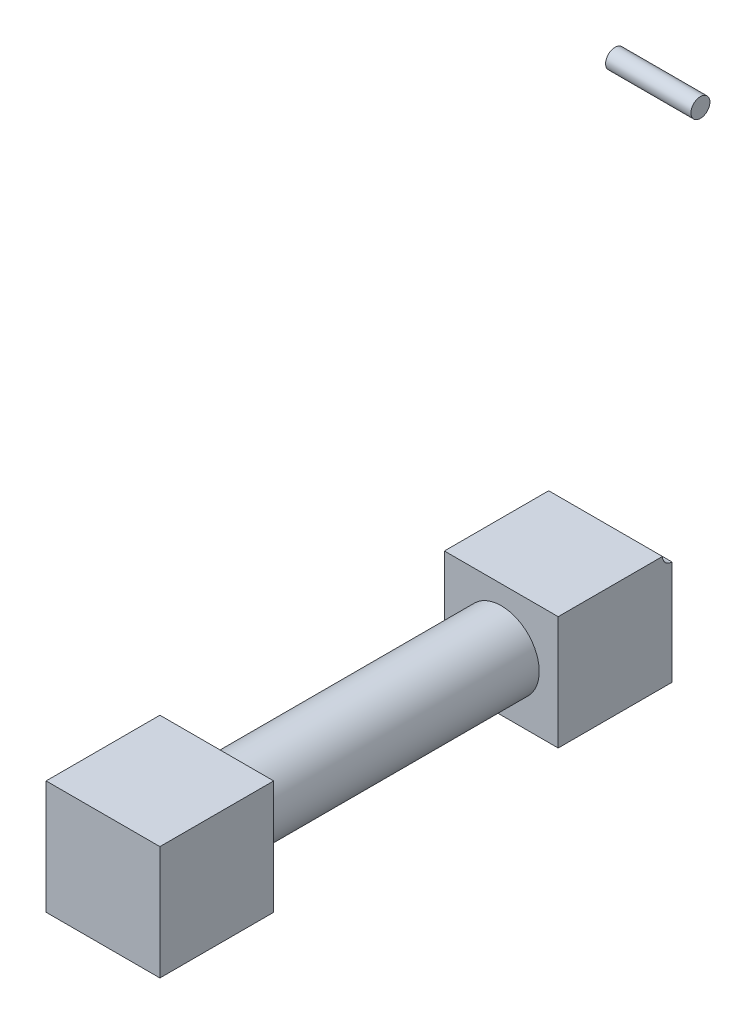
from build123d import *

# Parameters (mm, degrees)
SKETCH1_W               = 60
SKETCH1_H               = 60
BOSS_EXTRUDE1_DEPTH     = 60
SKETCH2_R               = 20
BOSS_EXTRUDE2_DEPTH     = 150
SKETCH3_W               = 60
SKETCH3_H               = 60
BOSS_EXTRUDE3_DEPTH     = 60
CUT_EXTRUDE1_DEPTH      = 100
CUT_EXTRUDE1_DEPTH_BACK = 100
SKETCH4_R               = 5
SKETCH6_R               = 5
BOSS_EXTRUDE4_DEPTH     = 45


with BuildPart() as part:
    # Sketch1 → Boss-Extrude1 (new body)
    with BuildSketch(Plane.XY):
        Rectangle(SKETCH1_W, SKETCH1_H)
    extrude(amount=BOSS_EXTRUDE1_DEPTH)

    # Sketch2 → Boss-Extrude2 (add)
    with BuildSketch(Plane.XY.offset(60)):
        Circle(SKETCH2_R)
    extrude(amount=BOSS_EXTRUDE2_DEPTH)

    # Sketch3 → Boss-Extrude3 (add)
    with BuildSketch(Plane.XY.offset(210)):
        Rectangle(SKETCH3_W, SKETCH3_H)
    extrude(amount=BOSS_EXTRUDE3_DEPTH)

    # Sketch4 → Cut-Extrude1 (cut, two sides: drawn at the far end of the back side and taken through both)
    with BuildSketch(Plane(origin=(0, 0, 0), x_dir=(0, 0, -1), z_dir=(1, 0, 0)).offset(-CUT_EXTRUDE1_DEPTH_BACK)):
        with Locations((0, 30)):
            Circle(SKETCH4_R)
    extrude(amount=CUT_EXTRUDE1_DEPTH + CUT_EXTRUDE1_DEPTH_BACK, mode=Mode.SUBTRACT)


with BuildPart() as body_2:
    # Sketch6 → Boss-Extrude4 (new body)
    with BuildSketch(Plane(origin=(0, 0, 0), x_dir=(0, 0, -1), z_dir=(1, 0, 0))):
        with Locations((0, 240)):
            Circle(SKETCH6_R)
    extrude(amount=BOSS_EXTRUDE4_DEPTH)


solid = Compound([part.part, body_2.part])
